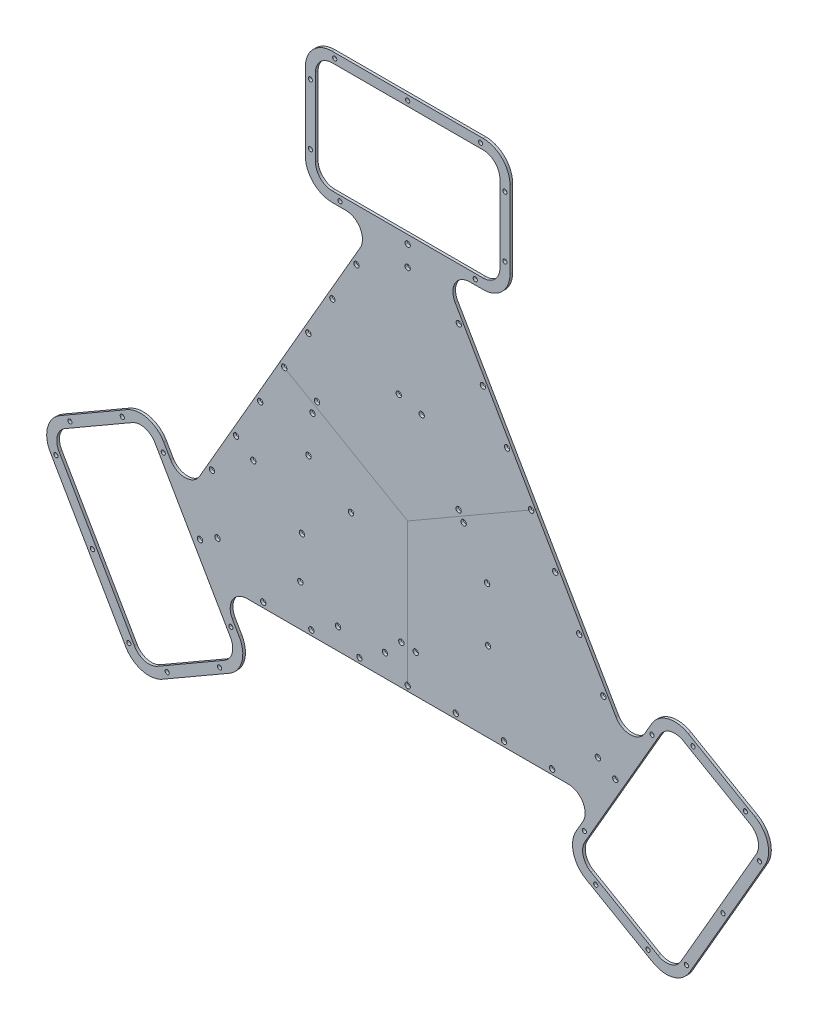
from build123d import *

# Parameters (mm, degrees)
BOSS_EXTRUDE2_DEPTH                   = 1.6
SKETCH2_W                             = 122
SKETCH2_H                             = 78.12
SKETCH2_W_2                           = 110
SKETCH2_H_2                           = 66.12
WHEEL_BUMPERS_DEPTH                   = 1.6
BUMPER_MOUNTING_HOLES_REACH           = 260.853
SKETCH3_R                             = 1.25
BUMPER_OUTER_FILLETS_R                = 16
BUMPER_INNER_FILLETS_R                = 10
CIRPATTERN3_COUNT                     = 3
BUMPER_OUTER_FILLETS_OF_CIRPATTERN3_R = 16
BUMPER_INNER_FILLETS_OF_CIRPATTERN3_R = 10
BUMPER_POCKET_FILLETS_R               = 10
MOTORS_REACH                          = 309.861
MOTOR_MOUNTING_HOLES_R                = 1.6
EXTENSION_BOARD_REACH                 = 309.861
SKETCH1_R                             = 1.6
SIDE_BUMPERS_REACH                    = 309.861
SKETCH6_R                             = 1.6
SPLIT1_SURFACE_1_BACK                 = 573.323
SPLIT1_SURFACE_1_DEPTH                = 1146.646
SPLIT1_SURFACE_2_BACK                 = 573.323
SPLIT1_SURFACE_2_DEPTH                = 1146.646
SKETCH11_R                            = 1.6
BATTERY_DEPTH                         = 1.6


with BuildPart() as part:
    # Master → Boss-Extrude2 (new body)
    with BuildSketch(Plane.XY):
        Polygon((-16.165807537, 147.976362049), (16.165807537, 147.976362049), (136.234192463, -59.988181024), (128.151288694, -73.988181024), (120.068384925, -87.988181024), (-120.068384925, -87.988181024), (-128.151288694, -73.988181024), (-136.234192463, -59.988181024), align=None)
    extrude(amount=BOSS_EXTRUDE2_DEPTH)

    # Sketch2 → Wheel bumpers (add)
    with BuildSketch(Plane.XY):
        with Locations((0, 181.036362049)):
            Rectangle(SKETCH2_W, SKETCH2_H)
        with Locations((0, 181.036362049)):
            Rectangle(SKETCH2_W_2, SKETCH2_H_2, mode=Mode.SUBTRACT)
    wheel_bumpers = extrude(amount=WHEEL_BUMPERS_DEPTH)

    # Sketch3 → Bumper mounting holes (cut, up to next)
    with BuildSketch(Plane.XY.offset(1.6), mode=Mode.PRIVATE) as bumper_mounting_holes_sk1:
        with Locations((43.5, 217.096362049)):
            Circle(SKETCH3_R)
    bumper_mounting_holes_tool1 = extrude(bumper_mounting_holes_sk1.sketch, amount=-BUMPER_MOUNTING_HOLES_REACH, mode=Mode.PRIVATE) & part.part
    # Sketch3 → Bumper mounting holes (cut, up to next)
    with BuildSketch(Plane.XY.offset(1.6), mode=Mode.PRIVATE) as bumper_mounting_holes_sk2:
        with Locations((0, 217.096362049)):
            Circle(SKETCH3_R)
    bumper_mounting_holes_tool2 = extrude(bumper_mounting_holes_sk2.sketch, amount=-BUMPER_MOUNTING_HOLES_REACH, mode=Mode.PRIVATE) & part.part
    # Sketch3 → Bumper mounting holes (cut, up to next)
    with BuildSketch(Plane.XY.offset(1.6), mode=Mode.PRIVATE) as bumper_mounting_holes_sk3:
        with Locations((-43.5, 217.096362049)):
            Circle(SKETCH3_R)
    bumper_mounting_holes_tool3 = extrude(bumper_mounting_holes_sk3.sketch, amount=-BUMPER_MOUNTING_HOLES_REACH, mode=Mode.PRIVATE) & part.part
    # Sketch3 → Bumper mounting holes (cut, up to next)
    with BuildSketch(Plane.XY.offset(1.6), mode=Mode.PRIVATE) as bumper_mounting_holes_sk4:
        with Locations((-58, 199.066362049)):
            Circle(SKETCH3_R)
    bumper_mounting_holes_tool4 = extrude(bumper_mounting_holes_sk4.sketch, amount=-BUMPER_MOUNTING_HOLES_REACH, mode=Mode.PRIVATE) & part.part
    # Sketch3 → Bumper mounting holes (cut, up to next)
    with BuildSketch(Plane.XY.offset(1.6), mode=Mode.PRIVATE) as bumper_mounting_holes_sk5:
        with Locations((-58, 163.006362049)):
            Circle(SKETCH3_R)
    bumper_mounting_holes_tool5 = extrude(bumper_mounting_holes_sk5.sketch, amount=-BUMPER_MOUNTING_HOLES_REACH, mode=Mode.PRIVATE) & part.part
    # Sketch3 → Bumper mounting holes (cut, up to next)
    with BuildSketch(Plane.XY.offset(1.6), mode=Mode.PRIVATE) as bumper_mounting_holes_sk6:
        with Locations((58, 199.066362049)):
            Circle(SKETCH3_R)
    bumper_mounting_holes_tool6 = extrude(bumper_mounting_holes_sk6.sketch, amount=-BUMPER_MOUNTING_HOLES_REACH, mode=Mode.PRIVATE) & part.part
    # Sketch3 → Bumper mounting holes (cut, up to next)
    with BuildSketch(Plane.XY.offset(1.6), mode=Mode.PRIVATE) as bumper_mounting_holes_sk7:
        with Locations((58, 163.006362049)):
            Circle(SKETCH3_R)
    bumper_mounting_holes_tool7 = extrude(bumper_mounting_holes_sk7.sketch, amount=-BUMPER_MOUNTING_HOLES_REACH, mode=Mode.PRIVATE) & part.part
    # Sketch3 → Bumper mounting holes (cut, up to next)
    with BuildSketch(Plane.XY.offset(1.6), mode=Mode.PRIVATE) as bumper_mounting_holes_sk8:
        with Locations((-40.314954576, 144.976362049)):
            Circle(SKETCH3_R)
    bumper_mounting_holes_tool8 = extrude(bumper_mounting_holes_sk8.sketch, amount=-BUMPER_MOUNTING_HOLES_REACH, mode=Mode.PRIVATE) & part.part
    # Sketch3 → Bumper mounting holes (cut, up to next)
    with BuildSketch(Plane.XY.offset(1.6), mode=Mode.PRIVATE) as bumper_mounting_holes_sk9:
        with Locations((40.314954576, 144.976362049)):
            Circle(SKETCH3_R)
    bumper_mounting_holes_tool9 = extrude(bumper_mounting_holes_sk9.sketch, amount=-BUMPER_MOUNTING_HOLES_REACH, mode=Mode.PRIVATE) & part.part
    bumper_mounting_holes_1 = bumper_mounting_holes_tool1.solids().sort_by_distance((43.5, 217.096362, 1.6))[0]
    add(bumper_mounting_holes_1, mode=Mode.SUBTRACT)
    bumper_mounting_holes_2 = bumper_mounting_holes_tool2.solids().sort_by_distance((0, 217.096362, 1.6))[0]
    add(bumper_mounting_holes_2, mode=Mode.SUBTRACT)
    bumper_mounting_holes_3 = bumper_mounting_holes_tool3.solids().sort_by_distance((-43.5, 217.096362, 1.6))[0]
    add(bumper_mounting_holes_3, mode=Mode.SUBTRACT)
    bumper_mounting_holes_4 = bumper_mounting_holes_tool4.solids().sort_by_distance((-58, 199.066362, 1.6))[0]
    add(bumper_mounting_holes_4, mode=Mode.SUBTRACT)
    bumper_mounting_holes_5 = bumper_mounting_holes_tool5.solids().sort_by_distance((-58, 163.006362, 1.6))[0]
    add(bumper_mounting_holes_5, mode=Mode.SUBTRACT)
    bumper_mounting_holes_6 = bumper_mounting_holes_tool6.solids().sort_by_distance((58, 199.066362, 1.6))[0]
    add(bumper_mounting_holes_6, mode=Mode.SUBTRACT)
    bumper_mounting_holes_7 = bumper_mounting_holes_tool7.solids().sort_by_distance((58, 163.006362, 1.6))[0]
    add(bumper_mounting_holes_7, mode=Mode.SUBTRACT)
    bumper_mounting_holes_8 = bumper_mounting_holes_tool8.solids().sort_by_distance((-40.314955, 144.976362, 1.6))[0]
    add(bumper_mounting_holes_8, mode=Mode.SUBTRACT)
    bumper_mounting_holes_9 = bumper_mounting_holes_tool9.solids().sort_by_distance((40.314955, 144.976362, 1.6))[0]
    add(bumper_mounting_holes_9, mode=Mode.SUBTRACT)
    bumper_mounting_holes = bumper_mounting_holes_1 + bumper_mounting_holes_2 + bumper_mounting_holes_3 + bumper_mounting_holes_4 + bumper_mounting_holes_5 + bumper_mounting_holes_6 + bumper_mounting_holes_7 + bumper_mounting_holes_8 + bumper_mounting_holes_9  # Bumper mounting holes as one shape, for the pattern or mirror that repeats it

    # Bumper outer fillets
    bumper_outer_fillets_edges = [part.edges().sort_by_distance(p)[0] for p in [
        (-61, 141.976362049, 0.8),
        (61, 141.976362049, 0.8),
        (61, 220.096362049, 0.8),
        (-61, 220.096362049, 0.8),
    ]]
    fillet(bumper_outer_fillets_edges, radius=BUMPER_OUTER_FILLETS_R)

    # Bumper inner fillets
    bumper_inner_fillets_edges = [part.edges().sort_by_distance(p)[0] for p in [
        (55, 147.976362049, 0.8),
        (55, 214.096362049, 0.8),
        (-55, 214.096362049, 0.8),
        (-55, 147.976362049, 0.8),
    ]]
    fillet(bumper_inner_fillets_edges, radius=BUMPER_INNER_FILLETS_R)

    # CirPattern3: Wheel bumpers, Bumper mounting holes ×3 about axis
    cirpattern3_axis = Axis((0, 0, 0), (0, 0, 1))
    add([wheel_bumpers.rotate(cirpattern3_axis, i * 360 / CIRPATTERN3_COUNT) for i in range(1, CIRPATTERN3_COUNT)])
    add([bumper_mounting_holes.rotate(cirpattern3_axis, i * 360 / CIRPATTERN3_COUNT) for i in range(1, CIRPATTERN3_COUNT)], mode=Mode.SUBTRACT)

    # Bumper outer fillets of CirPattern3
    bumper_outer_fillets_of_cirpattern3_edges = [part.edges().sort_by_distance(p)[0] for p in [
        (-92.455136271, -123.815730655, 0.8),
        (-153.455136271, -18.160631394, 0.8),
        (-221.109040815, -57.220631394, 0.8),
        (-160.109040815, -162.875730655, 0.8),
        (153.455136271, -18.160631394, 0.8),
        (92.455136271, -123.815730655, 0.8),
        (160.109040815, -162.875730655, 0.8),
        (221.109040815, -57.220631394, 0.8),
    ]]
    fillet(bumper_outer_fillets_of_cirpattern3_edges, radius=BUMPER_OUTER_FILLETS_OF_CIRPATTERN3_R)

    # Bumper inner fillets of CirPattern3
    bumper_inner_fillets_of_cirpattern3_edges = [part.edges().sort_by_distance(p)[0] for p in [
        (-155.651288694, -26.356783816, 0.8),
        (-212.912888392, -59.416783816, 0.8),
        (-157.912888392, -154.679578233, 0.8),
        (-100.651288694, -121.619578233, 0.8),
        (100.651288694, -121.619578233, 0.8),
        (157.912888392, -154.679578233, 0.8),
        (212.912888392, -59.416783816, 0.8),
        (155.651288694, -26.356783816, 0.8),
    ]]
    fillet(bumper_inner_fillets_of_cirpattern3_edges, radius=BUMPER_INNER_FILLETS_OF_CIRPATTERN3_R)

    # Bumper pocket fillets
    bumper_pocket_fillets_edges = [part.edges().sort_by_distance(p)[0] for p in [
        (-132.770090848, -53.988181024, 0.8),
        (-113.140181695, -87.988181024, 0.8),
        (113.140181695, -87.988181024, 0.8),
        (132.770090848, -53.988181024, 0.8),
        (-19.629909152, 141.976362049, 0.8),
        (19.629909152, 141.976362049, 0.8),
    ]]
    fillet(bumper_pocket_fillets_edges, radius=BUMPER_POCKET_FILLETS_R)

    # Motor mounting holes → Motors (cut, up to next)
    with BuildSketch(Plane.XY, mode=Mode.PRIVATE) as motors_sk1:
        with Locations(Location((0, 142.976362049, 0), (0, 0, 180))):
            Circle(MOTOR_MOUNTING_HOLES_R)
    motors_tool1 = extrude(motors_sk1.sketch, amount=MOTORS_REACH, mode=Mode.PRIVATE) & part.part
    # Motor mounting holes → Motors (cut, up to next)
    with BuildSketch(Plane.XY, mode=Mode.PRIVATE) as motors_sk2:
        with Locations(Location((0, 130.976362049, 0), (0, 0, 180))):
            Circle(MOTOR_MOUNTING_HOLES_R)
    motors_tool2 = extrude(motors_sk2.sketch, amount=MOTORS_REACH, mode=Mode.PRIVATE) & part.part
    # Motor mounting holes → Motors (cut, up to next)
    with BuildSketch(Plane.XY, mode=Mode.PRIVATE) as motors_sk3:
        with Locations(Location((-113.42885683, -65.488181024, 0), (0, 0, 180))):
            Circle(MOTOR_MOUNTING_HOLES_R)
    motors_tool3 = extrude(motors_sk3.sketch, amount=MOTORS_REACH, mode=Mode.PRIVATE) & part.part
    # Motor mounting holes → Motors (cut, up to next)
    with BuildSketch(Plane.XY, mode=Mode.PRIVATE) as motors_sk4:
        with Locations(Location((-123.821161675, -71.488181024, 0), (0, 0, 180))):
            Circle(MOTOR_MOUNTING_HOLES_R)
    motors_tool4 = extrude(motors_sk4.sketch, amount=MOTORS_REACH, mode=Mode.PRIVATE) & part.part
    # Motor mounting holes → Motors (cut, up to next)
    with BuildSketch(Plane.XY, mode=Mode.PRIVATE) as motors_sk5:
        with Locations(Location((113.42885683, -65.488181024, 0), (0, 0, 180))):
            Circle(MOTOR_MOUNTING_HOLES_R)
    motors_tool5 = extrude(motors_sk5.sketch, amount=MOTORS_REACH, mode=Mode.PRIVATE) & part.part
    # Motor mounting holes → Motors (cut, up to next)
    with BuildSketch(Plane.XY, mode=Mode.PRIVATE) as motors_sk6:
        with Locations(Location((123.821161675, -71.488181024, 0), (0, 0, 180))):
            Circle(MOTOR_MOUNTING_HOLES_R)
    motors_tool6 = extrude(motors_sk6.sketch, amount=MOTORS_REACH, mode=Mode.PRIVATE) & part.part
    add(motors_tool1.solids().sort_by_distance((0, 142.976362, 0))[0], mode=Mode.SUBTRACT)
    add(motors_tool2.solids().sort_by_distance((0, 130.976362, 0))[0], mode=Mode.SUBTRACT)
    add(motors_tool3.solids().sort_by_distance((-113.428857, -65.488181, 0))[0], mode=Mode.SUBTRACT)
    add(motors_tool4.solids().sort_by_distance((-123.821162, -71.488181, 0))[0], mode=Mode.SUBTRACT)
    add(motors_tool5.solids().sort_by_distance((113.428857, -65.488181, 0))[0], mode=Mode.SUBTRACT)
    add(motors_tool6.solids().sort_by_distance((123.821162, -71.488181, 0))[0], mode=Mode.SUBTRACT)

    # Sketch1 → Extension board (cut, up to next)
    with BuildSketch(Plane.XY.offset(1.6), mode=Mode.PRIVATE) as extension_board_sk1:
        with Locations((-92.02881267, -14.801420696)):
            Circle(SKETCH1_R)
    extension_board_tool1 = extrude(extension_board_sk1.sketch, amount=-EXTENSION_BOARD_REACH, mode=Mode.PRIVATE) & part.part
    # Sketch1 → Extension board (cut, up to next)
    with BuildSketch(Plane.XY.offset(1.6), mode=Mode.PRIVATE) as extension_board_sk2:
        with Locations((-63.038469719, -38.014167616)):
            Circle(SKETCH1_R)
    extension_board_tool2 = extrude(extension_board_sk2.sketch, amount=-EXTENSION_BOARD_REACH, mode=Mode.PRIVATE) & part.part
    # Sketch1 → Extension board (cut, up to next)
    with BuildSketch(Plane.XY.offset(1.6), mode=Mode.PRIVATE) as extension_board_sk3:
        with Locations((-63.97981267, -63.383713797)):
            Circle(SKETCH1_R)
    extension_board_tool3 = extrude(extension_board_sk3.sketch, amount=-EXTENSION_BOARD_REACH, mode=Mode.PRIVATE) & part.part
    # Sketch1 → Extension board (cut, up to next)
    with BuildSketch(Plane.XY.offset(1.6), mode=Mode.PRIVATE) as extension_board_sk4:
        with Locations((-41.538469719, -75.253259979)):
            Circle(SKETCH1_R)
    extension_board_tool4 = extrude(extension_board_sk4.sketch, amount=-EXTENSION_BOARD_REACH, mode=Mode.PRIVATE) & part.part
    # Sketch1 → Extension board (cut, up to next)
    with BuildSketch(Plane.XY.offset(1.6), mode=Mode.PRIVATE) as extension_board_sk5:
        with Locations((-13.521847326, -74.779473419)):
            Circle(SKETCH1_R)
    extension_board_tool5 = extrude(extension_board_sk5.sketch, amount=-EXTENSION_BOARD_REACH, mode=Mode.PRIVATE) & part.part
    # Sketch1 → Extension board (cut, up to next)
    with BuildSketch(Plane.XY.offset(1.6), mode=Mode.PRIVATE) as extension_board_sk6:
        with Locations((-59.119847326, 4.198579304)):
            Circle(SKETCH1_R)
    extension_board_tool6 = extrude(extension_board_sk6.sketch, amount=-EXTENSION_BOARD_REACH, mode=Mode.PRIVATE) & part.part
    add(extension_board_tool1.solids().sort_by_distance((-92.028813, -14.801421, 1.6))[0], mode=Mode.SUBTRACT)
    add(extension_board_tool2.solids().sort_by_distance((-63.03847, -38.014168, 1.6))[0], mode=Mode.SUBTRACT)
    add(extension_board_tool3.solids().sort_by_distance((-63.979813, -63.383714, 1.6))[0], mode=Mode.SUBTRACT)
    add(extension_board_tool4.solids().sort_by_distance((-41.53847, -75.25326, 1.6))[0], mode=Mode.SUBTRACT)
    add(extension_board_tool5.solids().sort_by_distance((-13.521847, -74.779473, 1.6))[0], mode=Mode.SUBTRACT)
    add(extension_board_tool6.solids().sort_by_distance((-59.119847, 4.198579, 1.6))[0], mode=Mode.SUBTRACT)

    # Sketch6 → Side bumpers (cut, up to next)
    with BuildSketch(Plane(origin=(0, 0, 0), x_dir=(-1, 0, 0), z_dir=(0, 0, -1)), mode=Mode.PRIVATE) as side_bumpers_sk1:
        with Locations((-86.154169801, -84.988173098)):
            Circle(SKETCH6_R)
    side_bumpers_tool1 = extrude(side_bumpers_sk1.sketch, amount=-SIDE_BUMPERS_REACH, mode=Mode.PRIVATE) & part.part
    # Sketch6 → Side bumpers (cut, up to next)
    with BuildSketch(Plane(origin=(0, 0, 0), x_dir=(-1, 0, 0), z_dir=(0, 0, -1)), mode=Mode.PRIVATE) as side_bumpers_sk2:
        with Locations((-57.436111675, -84.988173098)):
            Circle(SKETCH6_R)
    side_bumpers_tool2 = extrude(side_bumpers_sk2.sketch, amount=-SIDE_BUMPERS_REACH, mode=Mode.PRIVATE) & part.part
    # Sketch6 → Side bumpers (cut, up to next)
    with BuildSketch(Plane(origin=(0, 0, 0), x_dir=(-1, 0, 0), z_dir=(0, 0, -1)), mode=Mode.PRIVATE) as side_bumpers_sk3:
        with Locations((-28.718053549, -84.988173098)):
            Circle(SKETCH6_R)
    side_bumpers_tool3 = extrude(side_bumpers_sk3.sketch, amount=-SIDE_BUMPERS_REACH, mode=Mode.PRIVATE) & part.part
    # Sketch6 → Side bumpers (cut, up to next)
    with BuildSketch(Plane(origin=(0, 0, 0), x_dir=(-1, 0, 0), z_dir=(0, 0, -1)), mode=Mode.PRIVATE) as side_bumpers_sk4:
        with Locations((4.576e-06, -84.988173098)):
            Circle(SKETCH6_R)
    side_bumpers_tool4 = extrude(side_bumpers_sk4.sketch, amount=-SIDE_BUMPERS_REACH, mode=Mode.PRIVATE) & part.part
    # Sketch6 → Side bumpers (cut, up to next)
    with BuildSketch(Plane(origin=(0, 0, 0), x_dir=(-1, 0, 0), z_dir=(0, 0, -1)), mode=Mode.PRIVATE) as side_bumpers_sk5:
        with Locations((28.718062702, -84.988173098)):
            Circle(SKETCH6_R)
    side_bumpers_tool5 = extrude(side_bumpers_sk5.sketch, amount=-SIDE_BUMPERS_REACH, mode=Mode.PRIVATE) & part.part
    # Sketch6 → Side bumpers (cut, up to next)
    with BuildSketch(Plane(origin=(0, 0, 0), x_dir=(-1, 0, 0), z_dir=(0, 0, -1)), mode=Mode.PRIVATE) as side_bumpers_sk6:
        with Locations((57.436120828, -84.988173098)):
            Circle(SKETCH6_R)
    side_bumpers_tool6 = extrude(side_bumpers_sk6.sketch, amount=-SIDE_BUMPERS_REACH, mode=Mode.PRIVATE) & part.part
    # Sketch6 → Side bumpers (cut, up to next)
    with BuildSketch(Plane(origin=(0, 0, 0), x_dir=(-1, 0, 0), z_dir=(0, 0, -1)), mode=Mode.PRIVATE) as side_bumpers_sk7:
        with Locations((86.154178953, -84.988173098)):
            Circle(SKETCH6_R)
    side_bumpers_tool7 = extrude(side_bumpers_sk7.sketch, amount=-SIDE_BUMPERS_REACH, mode=Mode.PRIVATE) & part.part
    # Sketch6 → Side bumpers (cut, up to next)
    with BuildSketch(Plane(origin=(0, 0, 0), x_dir=(-1, 0, 0), z_dir=(0, 0, -1)), mode=Mode.PRIVATE) as side_bumpers_sk8:
        with Locations((116.679001825, -32.11761314)):
            Circle(SKETCH6_R)
    side_bumpers_tool8 = extrude(side_bumpers_sk8.sketch, amount=-SIDE_BUMPERS_REACH, mode=Mode.PRIVATE) & part.part
    # Sketch6 → Side bumpers (cut, up to next)
    with BuildSketch(Plane(origin=(0, 0, 0), x_dir=(-1, 0, 0), z_dir=(0, 0, -1)), mode=Mode.PRIVATE) as side_bumpers_sk9:
        with Locations((102.319972762, -7.247045256)):
            Circle(SKETCH6_R)
    side_bumpers_tool9 = extrude(side_bumpers_sk9.sketch, amount=-SIDE_BUMPERS_REACH, mode=Mode.PRIVATE) & part.part
    # Sketch6 → Side bumpers (cut, up to next)
    with BuildSketch(Plane(origin=(0, 0, 0), x_dir=(-1, 0, 0), z_dir=(0, 0, -1)), mode=Mode.PRIVATE) as side_bumpers_sk10:
        with Locations((87.960943699, 17.623522628)):
            Circle(SKETCH6_R)
    side_bumpers_tool10 = extrude(side_bumpers_sk10.sketch, amount=-SIDE_BUMPERS_REACH, mode=Mode.PRIVATE) & part.part
    # Sketch6 → Side bumpers (cut, up to next)
    with BuildSketch(Plane(origin=(0, 0, 0), x_dir=(-1, 0, 0), z_dir=(0, 0, -1)), mode=Mode.PRIVATE) as side_bumpers_sk11:
        with Locations((73.601914636, 42.494090512)):
            Circle(SKETCH6_R)
    side_bumpers_tool11 = extrude(side_bumpers_sk11.sketch, amount=-SIDE_BUMPERS_REACH, mode=Mode.PRIVATE) & part.part
    # Sketch6 → Side bumpers (cut, up to next)
    with BuildSketch(Plane(origin=(0, 0, 0), x_dir=(-1, 0, 0), z_dir=(0, 0, -1)), mode=Mode.PRIVATE) as side_bumpers_sk12:
        with Locations((59.242885573, 67.364658396)):
            Circle(SKETCH6_R)
    side_bumpers_tool12 = extrude(side_bumpers_sk12.sketch, amount=-SIDE_BUMPERS_REACH, mode=Mode.PRIVATE) & part.part
    # Sketch6 → Side bumpers (cut, up to next)
    with BuildSketch(Plane(origin=(0, 0, 0), x_dir=(-1, 0, 0), z_dir=(0, 0, -1)), mode=Mode.PRIVATE) as side_bumpers_sk13:
        with Locations((44.883856511, 92.235226281)):
            Circle(SKETCH6_R)
    side_bumpers_tool13 = extrude(side_bumpers_sk13.sketch, amount=-SIDE_BUMPERS_REACH, mode=Mode.PRIVATE) & part.part
    # Sketch6 → Side bumpers (cut, up to next)
    with BuildSketch(Plane(origin=(0, 0, 0), x_dir=(-1, 0, 0), z_dir=(0, 0, -1)), mode=Mode.PRIVATE) as side_bumpers_sk14:
        with Locations((30.524827448, 117.105794165)):
            Circle(SKETCH6_R)
    side_bumpers_tool14 = extrude(side_bumpers_sk14.sketch, amount=-SIDE_BUMPERS_REACH, mode=Mode.PRIVATE) & part.part
    # Sketch6 → Side bumpers (cut, up to next)
    with BuildSketch(Plane(origin=(0, 0, 0), x_dir=(-1, 0, 0), z_dir=(0, 0, -1)), mode=Mode.PRIVATE) as side_bumpers_sk15:
        with Locations((-30.524832024, 117.105786239)):
            Circle(SKETCH6_R)
    side_bumpers_tool15 = extrude(side_bumpers_sk15.sketch, amount=-SIDE_BUMPERS_REACH, mode=Mode.PRIVATE) & part.part
    # Sketch6 → Side bumpers (cut, up to next)
    with BuildSketch(Plane(origin=(0, 0, 0), x_dir=(-1, 0, 0), z_dir=(0, 0, -1)), mode=Mode.PRIVATE) as side_bumpers_sk16:
        with Locations((-44.883861087, 92.235218354)):
            Circle(SKETCH6_R)
    side_bumpers_tool16 = extrude(side_bumpers_sk16.sketch, amount=-SIDE_BUMPERS_REACH, mode=Mode.PRIVATE) & part.part
    # Sketch6 → Side bumpers (cut, up to next)
    with BuildSketch(Plane(origin=(0, 0, 0), x_dir=(-1, 0, 0), z_dir=(0, 0, -1)), mode=Mode.PRIVATE) as side_bumpers_sk17:
        with Locations((-59.24289015, 67.36465047)):
            Circle(SKETCH6_R)
    side_bumpers_tool17 = extrude(side_bumpers_sk17.sketch, amount=-SIDE_BUMPERS_REACH, mode=Mode.PRIVATE) & part.part
    # Sketch6 → Side bumpers (cut, up to next)
    with BuildSketch(Plane(origin=(0, 0, 0), x_dir=(-1, 0, 0), z_dir=(0, 0, -1)), mode=Mode.PRIVATE) as side_bumpers_sk18:
        with Locations((-73.601919212, 42.494082586)):
            Circle(SKETCH6_R)
    side_bumpers_tool18 = extrude(side_bumpers_sk18.sketch, amount=-SIDE_BUMPERS_REACH, mode=Mode.PRIVATE) & part.part
    # Sketch6 → Side bumpers (cut, up to next)
    with BuildSketch(Plane(origin=(0, 0, 0), x_dir=(-1, 0, 0), z_dir=(0, 0, -1)), mode=Mode.PRIVATE) as side_bumpers_sk19:
        with Locations((-87.960948275, 17.623514702)):
            Circle(SKETCH6_R)
    side_bumpers_tool19 = extrude(side_bumpers_sk19.sketch, amount=-SIDE_BUMPERS_REACH, mode=Mode.PRIVATE) & part.part
    # Sketch6 → Side bumpers (cut, up to next)
    with BuildSketch(Plane(origin=(0, 0, 0), x_dir=(-1, 0, 0), z_dir=(0, 0, -1)), mode=Mode.PRIVATE) as side_bumpers_sk20:
        with Locations((-102.319977338, -7.247053182)):
            Circle(SKETCH6_R)
    side_bumpers_tool20 = extrude(side_bumpers_sk20.sketch, amount=-SIDE_BUMPERS_REACH, mode=Mode.PRIVATE) & part.part
    # Sketch6 → Side bumpers (cut, up to next)
    with BuildSketch(Plane(origin=(0, 0, 0), x_dir=(-1, 0, 0), z_dir=(0, 0, -1)), mode=Mode.PRIVATE) as side_bumpers_sk21:
        with Locations((-116.679006401, -32.117621067)):
            Circle(SKETCH6_R)
    side_bumpers_tool21 = extrude(side_bumpers_sk21.sketch, amount=-SIDE_BUMPERS_REACH, mode=Mode.PRIVATE) & part.part
    add(side_bumpers_tool1.solids().sort_by_distance((86.15417, -84.988173, 0))[0], mode=Mode.SUBTRACT)
    add(side_bumpers_tool2.solids().sort_by_distance((57.436112, -84.988173, 0))[0], mode=Mode.SUBTRACT)
    add(side_bumpers_tool3.solids().sort_by_distance((28.718054, -84.988173, 0))[0], mode=Mode.SUBTRACT)
    add(side_bumpers_tool4.solids().sort_by_distance((-5e-06, -84.988173, 0))[0], mode=Mode.SUBTRACT)
    add(side_bumpers_tool5.solids().sort_by_distance((-28.718063, -84.988173, 0))[0], mode=Mode.SUBTRACT)
    add(side_bumpers_tool6.solids().sort_by_distance((-57.436121, -84.988173, 0))[0], mode=Mode.SUBTRACT)
    add(side_bumpers_tool7.solids().sort_by_distance((-86.154179, -84.988173, 0))[0], mode=Mode.SUBTRACT)
    add(side_bumpers_tool8.solids().sort_by_distance((-116.679002, -32.117613, 0))[0], mode=Mode.SUBTRACT)
    add(side_bumpers_tool9.solids().sort_by_distance((-102.319973, -7.247045, 0))[0], mode=Mode.SUBTRACT)
    add(side_bumpers_tool10.solids().sort_by_distance((-87.960944, 17.623523, 0))[0], mode=Mode.SUBTRACT)
    add(side_bumpers_tool11.solids().sort_by_distance((-73.601915, 42.494091, 0))[0], mode=Mode.SUBTRACT)
    add(side_bumpers_tool12.solids().sort_by_distance((-59.242886, 67.364658, 0))[0], mode=Mode.SUBTRACT)
    add(side_bumpers_tool13.solids().sort_by_distance((-44.883857, 92.235226, 0))[0], mode=Mode.SUBTRACT)
    add(side_bumpers_tool14.solids().sort_by_distance((-30.524827, 117.105794, 0))[0], mode=Mode.SUBTRACT)
    add(side_bumpers_tool15.solids().sort_by_distance((30.524832, 117.105786, 0))[0], mode=Mode.SUBTRACT)
    add(side_bumpers_tool16.solids().sort_by_distance((44.883861, 92.235218, 0))[0], mode=Mode.SUBTRACT)
    add(side_bumpers_tool17.solids().sort_by_distance((59.24289, 67.36465, 0))[0], mode=Mode.SUBTRACT)
    add(side_bumpers_tool18.solids().sort_by_distance((73.601919, 42.494083, 0))[0], mode=Mode.SUBTRACT)
    add(side_bumpers_tool19.solids().sort_by_distance((87.960948, 17.623515, 0))[0], mode=Mode.SUBTRACT)
    add(side_bumpers_tool20.solids().sort_by_distance((102.319977, -7.247053, 0))[0], mode=Mode.SUBTRACT)
    add(side_bumpers_tool21.solids().sort_by_distance((116.679006, -32.117621, 0))[0], mode=Mode.SUBTRACT)


with BuildPart() as body_2:
    # Split1: the piece behind the surface
    add(part.part)
    # Split1 surface: a surface, the sketch's curves swept straight by 1146.646 mm
    with BuildLine(Plane.XY.offset(-SPLIT1_SURFACE_1_BACK), mode=Mode.PRIVATE) as split1_surface_1_path:
        Line((0, -87.988181024), (0, 0))
        Line((0, 0), (-76.2, 43.994090512))
    split1_surface_1 = Shell.extrude(split1_surface_1_path.wire(), (0 * SPLIT1_SURFACE_1_DEPTH, 0 * SPLIT1_SURFACE_1_DEPTH, 1 * SPLIT1_SURFACE_1_DEPTH))
    split(bisect_by=split1_surface_1, keep=Keep.BOTTOM)


with BuildPart() as part_1:
    add(part.part)

    # Split1: split by a surface, the side it looks to stays
    # Split1 surface: a surface, the sketch's curves swept straight by 1146.646 mm
    with BuildLine(Plane.XY.offset(-SPLIT1_SURFACE_2_BACK), mode=Mode.PRIVATE) as split1_surface_2_path:
        Line((0, -87.988181024), (0, 0))
        Line((0, 0), (-76.2, 43.994090512))
    split1_surface_2 = Shell.extrude(split1_surface_2_path.wire(), (0 * SPLIT1_SURFACE_2_DEPTH, 0 * SPLIT1_SURFACE_2_DEPTH, 1 * SPLIT1_SURFACE_2_DEPTH))
    split(bisect_by=split1_surface_2, keep=Keep.TOP)


with BuildPart() as body_3:
    # Split2: the piece on the far side of the plane
    add(body_2.part)
    split(bisect_by=Plane(origin=(0, 0, 0), x_dir=(0.8660254037844387, 0.5, 0), z_dir=(-0.5, 0.8660254037844387, 0)), keep=Keep.BOTTOM)


with BuildPart() as body_2_1:
    add(body_2.part)

    # Split2
    split(bisect_by=Plane(origin=(0, 0, 0), x_dir=(0.8660254037844387, 0.5, 0), z_dir=(-0.5, 0.8660254037844387, 0)), keep=Keep.TOP)


with BuildPart() as battery_tool:
    # Sketch11 → Battery (new body)
    with BuildSketch(Plane.XY):
        with Locations(Location((-54.047749412, 34.613448016, 0), (0, 0, 180))):
            Circle(SKETCH11_R)
        with Locations(Location((-56.743901834, 27.283320997, 0), (0, 0, 180))):
            Circle(SKETCH11_R)
        with Locations(Location((-5.290519179, 62.763448016, 0), (0, 0, 180))):
            Circle(SKETCH11_R)
        with Locations(Location((8.369734859, 59.103193978, 0), (0, 0, 180))):
            Circle(SKETCH11_R)
        with Locations(Location((30.369734859, 20.998076211, 0), (0, 0, 180))):
            Circle(SKETCH11_R)
        with Locations(Location((33.369734859, 15.801923789, 0), (0, 0, 180))):
            Circle(SKETCH11_R)
        with Locations(Location((47.369734859, -8.446787517, 0), (0, 0, 180))):
            Circle(SKETCH11_R)
        with Locations(Location((47.946341101, -40.445498823, 0), (0, 0, 180))):
            Circle(SKETCH11_R)
        with Locations(Location((4.818275992, -65.345498823, 0), (0, 0, 180))):
            Circle(SKETCH11_R)
        with Locations(Location((-3.743901834, -64.515371804, 0), (0, 0, 180))):
            Circle(SKETCH11_R)
        with Locations(Location((-33.743901834, -12.553847577, 0), (0, 0, 180))):
            Circle(SKETCH11_R)
    extrude(amount=BATTERY_DEPTH)


with BuildPart() as part_2:
    add(part_1.part)

    # Battery: cut by battery_tool
    add(battery_tool.part, mode=Mode.SUBTRACT)


with BuildPart() as body_2_2:
    add(body_2_1.part)

    # Battery: cut by battery_tool
    add(battery_tool.part, mode=Mode.SUBTRACT)


with BuildPart() as body_3_1:
    add(body_3.part)

    # Battery: cut by battery_tool
    add(battery_tool.part, mode=Mode.SUBTRACT)


solid = Compound([part_2.part, body_2_2.part, body_3_1.part])
